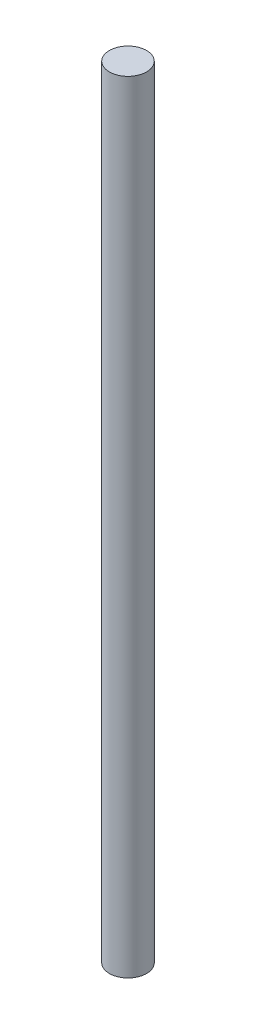
from build123d import *

# Parameters (mm, degrees)
SKETCH1_R           = 4.7625
BOSS_EXTRUDE1_DEPTH = 200


with BuildPart() as part:
    # Sketch1 → Boss-Extrude1 (new body)
    with BuildSketch(Plane(origin=(0, 0, 0), x_dir=(1, 0, 0), z_dir=(0, 1, 0))):
        with Locations(Location((0, 0, 0), (0, 0, 270))):
            Circle(SKETCH1_R)
    extrude(amount=BOSS_EXTRUDE1_DEPTH)


solid = part.part
